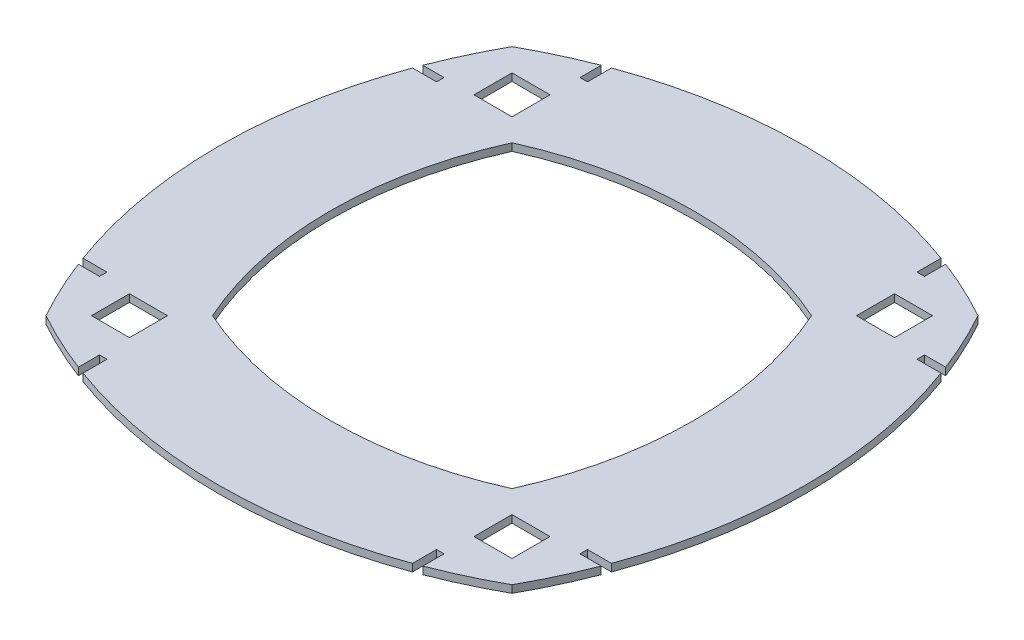
from build123d import *

# Parameters (mm, degrees)
SKETCH1_W           = 25.4
SKETCH1_H           = 25.4
BOSS_EXTRUDE1_DEPTH = 5


with BuildPart() as part:
    # Sketch1 → Boss-Extrude1 (new body)
    with BuildSketch(Plane(origin=(0, 0, 0), x_dir=(1, 0, 0), z_dir=(0, 1, 0))):
        with BuildLine():
            Line((115, 160.4), (110, 160.4))
            Line((110, 160.4), (110, 176.422793918))
            ThreePointArc((110, 176.422793918), (0, 195.923209892), (-110, 176.422793918))
            Line((-110, 176.422793918), (-110, 160.4))
            Line((-110, 160.4), (-115, 160.4))
            Line((-115, 160.4), (-115, 174.545044324))
            ThreePointArc((-115, 174.545044324), (-135.614952446, 165.765554405), (-155.565, 155.565))
            ThreePointArc((-155.565, 155.565), (-165.765554405, 135.614952446), (-174.545044324, 115))
            Line((-174.545044324, 115), (-160.4, 115))
            Line((-160.4, 115), (-160.4, 110))
            Line((-160.4, 110), (-176.422793918, 110))
            ThreePointArc((-176.422793918, 110), (-195.923209892, 0), (-176.422793918, -110))
            Line((-176.422793918, -110), (-160.4, -110))
            Line((-160.4, -110), (-160.4, -115))
            Line((-160.4, -115), (-174.545044324, -115))
            ThreePointArc((-174.545044324, -115), (-165.765554405, -135.614952446), (-155.565, -155.565))
            ThreePointArc((-155.565, -155.565), (-135.614952446, -165.765554405), (-115, -174.545044324))
            Line((-115, -174.545044324), (-115, -160.4))
            Line((-115, -160.4), (-110, -160.4))
            Line((-110, -160.4), (-110, -176.422793918))
            ThreePointArc((-110, -176.422793918), (0, -195.923209892), (110, -176.422793918))
            Line((110, -176.422793918), (110, -160.4))
            Line((110, -160.4), (115, -160.4))
            Line((115, -160.4), (115, -174.545044324))
            ThreePointArc((115, -174.545044324), (135.614952446, -165.765554405), (155.565, -155.565))
            ThreePointArc((155.565, -155.565), (165.765554405, -135.614952446), (174.545044324, -115))
            Line((174.545044324, -115), (160.4, -115))
            Line((160.4, -115), (160.4, -110))
            Line((160.4, -110), (176.422793918, -110))
            ThreePointArc((176.422793918, -110), (195.923209892, 0), (176.422793918, 110))
            Line((176.422793918, 110), (160.4, 110))
            Line((160.4, 110), (160.4, 115))
            Line((160.4, 115), (174.545044324, 115))
            ThreePointArc((174.545044324, 115), (165.765554405, 135.614952446), (155.565, 155.565))
            ThreePointArc((155.565, 155.565), (135.614952446, 165.765554405), (115, 174.545044324))
            Line((115, 174.545044324), (115, 160.4))
        make_face()
        with Locations((127.7, 127.7)):
            Rectangle(SKETCH1_W, SKETCH1_H, mode=Mode.SUBTRACT)
        with Locations((-127.7, 127.7)):
            Rectangle(SKETCH1_W, SKETCH1_H, mode=Mode.SUBTRACT)
        with Locations((127.7, -127.7)):
            Rectangle(SKETCH1_W, SKETCH1_H, mode=Mode.SUBTRACT)
        with Locations((-127.7, -127.7)):
            Rectangle(SKETCH1_W, SKETCH1_H, mode=Mode.SUBTRACT)
        with BuildLine():
            ThreePointArc((-100, 100), (0, 121.301301549), (100, 100))
            ThreePointArc((100, 100), (121.301301549, 0), (100, -100))
            ThreePointArc((100, -100), (0, -121.301301549), (-100, -100))
            ThreePointArc((-100, -100), (-121.301301549, 0), (-100, 100))
        make_face(mode=Mode.SUBTRACT)
    extrude(amount=BOSS_EXTRUDE1_DEPTH)


solid = part.part
